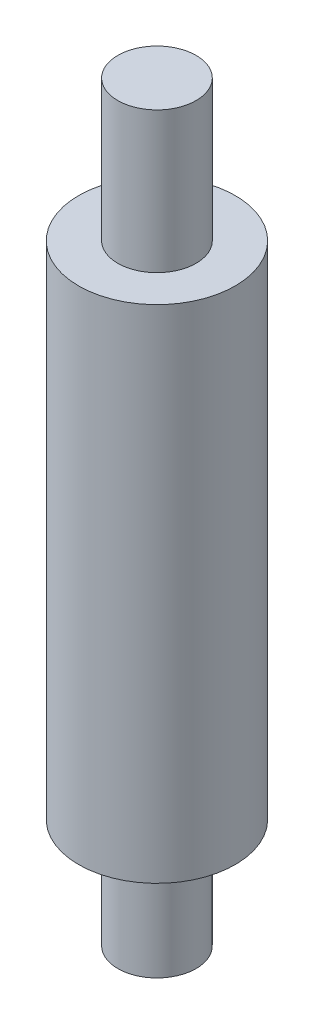
from build123d import *

# Parameters (mm, degrees)
SKETCH1_R           = 2.5
BOSS_EXTRUDE1_DEPTH = 16
SKETCH2_R           = 1.25
BOSS_EXTRUDE2_DEPTH = 4.5
BOSS_EXTRUDE3_START = 3.5
SKETCH3_R           = 1.25
BOSS_EXTRUDE3_DEPTH = 3.5


with BuildPart() as part:
    # Sketch1 → Boss-Extrude1 (new body)
    with BuildSketch(Plane(origin=(0, 0, 0), x_dir=(1, 0, 0), z_dir=(0, 1, 0))):
        with Locations(Location((0, 0, 0), (0, 0, 270))):
            Circle(SKETCH1_R)
    extrude(amount=BOSS_EXTRUDE1_DEPTH)

    # Sketch2 → Boss-Extrude2 (add)
    with BuildSketch(Plane(origin=(0, 16, 0), x_dir=(1, 0, 0), z_dir=(0, 1, 0))):
        with Locations(Location((0, 0, 0), (0, 0, 270))):
            Circle(SKETCH2_R)
    extrude(amount=BOSS_EXTRUDE2_DEPTH)

    # Sketch3 → Boss-Extrude3 (add)
    with BuildSketch(Plane(origin=(0, 0, 0), x_dir=(-1, 0, 0), z_dir=(0, -1, 0)).offset(BOSS_EXTRUDE3_START)):
        with Locations(Location((0, 0, 0), (0, 0, 270))):
            Circle(SKETCH3_R)
    extrude(amount=-BOSS_EXTRUDE3_DEPTH)


solid = part.part
